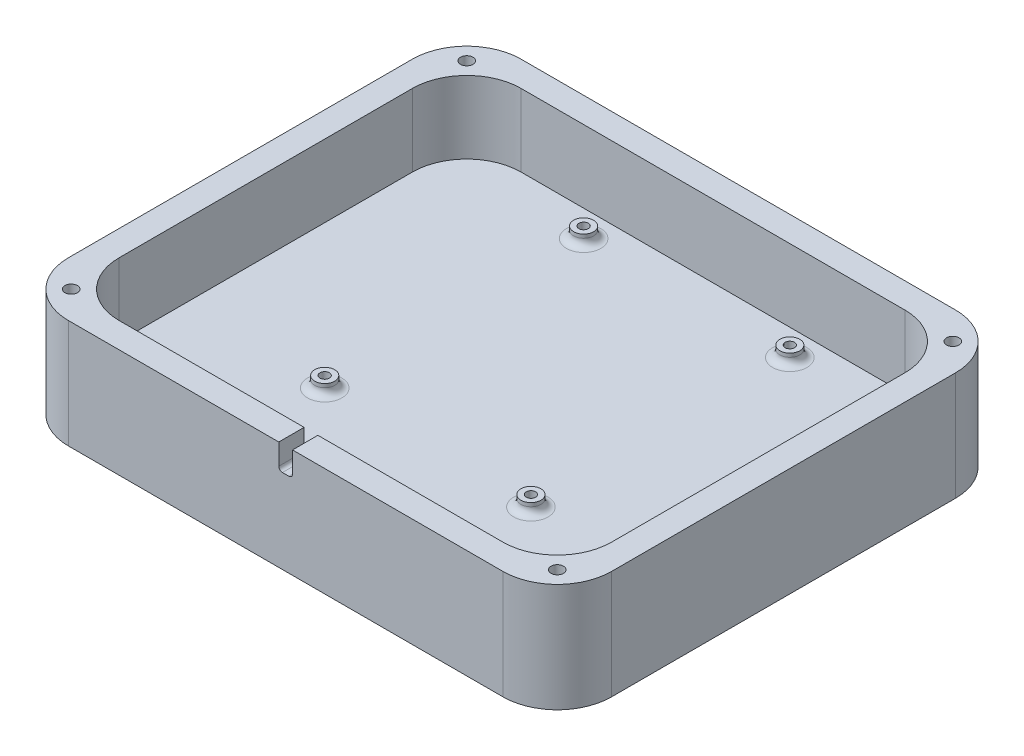
from build123d import *

# Parameters (mm, degrees)
SKETCH1_W                 = 150
SKETCH1_H                 = 100
BOSS_EXTRUDE1_DEPTH       = 10
SKETCH2_R                 = 2.75
BOSS_EXTRUDE2_DEPTH       = 3
F_1_0MM_DOWEL_HOLE1_D     = 2.6
F_1_0MM_DOWEL_HOLE1_DEPTH = 10
F_1_0MM_DOWEL_HOLE1_TIP   = 0.781118805
FILLET1_R                 = 2
SKETCH5_W                 = 150
SKETCH5_H                 = 25
BOSS_EXTRUDE3_DEPTH       = 10
SKETCH7_W                 = 150
SKETCH7_H                 = 125
SKETCH7_W_2               = 136
SKETCH7_H_2               = 111
EXTRUDE_THIN1_DEPTH       = 20
CUT_EXTRUDE1_REACH        = 150.829
FILLET2_R                 = 15
FILLET3_R                 = 15
SKETCH9_R                 = 1.725
CUT_EXTRUDE2_DEPTH        = 6


with BuildPart() as part:
    # Sketch1 → Boss-Extrude1 (new body)
    with BuildSketch(Plane(origin=(0, 0, 0), x_dir=(1, 0, 0), z_dir=(0, 1, 0))):
        Rectangle(SKETCH1_W, SKETCH1_H)
    extrude(amount=BOSS_EXTRUDE1_DEPTH)

    # Sketch2 → Boss-Extrude2 (add)
    with BuildSketch(Plane(origin=(0, 10, 0), x_dir=(1, 0, 0), z_dir=(0, 1, 0))):
        with Locations(Location((28.47, 35.745, 0), (0, 0, 270))):
            Circle(SKETCH2_R)
        with Locations(Location((28.47, -35.745, 0), (0, 0, 90))):
            Circle(SKETCH2_R)
        with Locations(Location((-28.47, -35.745, 0), (0, 0, 270))):
            Circle(SKETCH2_R)
        with Locations(Location((-28.47, 35.745, 0), (0, 0, 90))):
            Circle(SKETCH2_R)
    extrude(amount=BOSS_EXTRUDE2_DEPTH)

    # Ø1.0mm Dowel Hole1
    with Locations(Plane(origin=(0, 13, 0), x_dir=(1, 0, 0), z_dir=(0, 1, 0))):
        with Locations((-28.47, 35.745), (28.47, 35.745), (28.47, -35.745), (-28.47, -35.745)):
            Hole(F_1_0MM_DOWEL_HOLE1_D / 2, depth=F_1_0MM_DOWEL_HOLE1_DEPTH)
            with Locations((0, 0, -(F_1_0MM_DOWEL_HOLE1_DEPTH + F_1_0MM_DOWEL_HOLE1_TIP / 2))):  # 118° drill point
                Cone(0, F_1_0MM_DOWEL_HOLE1_D / 2, F_1_0MM_DOWEL_HOLE1_TIP, mode=Mode.SUBTRACT)

    # Fillet1
    fillet1_edges = [part.edges().sort_by_distance(p)[0] for p in [
        (-28.47, 10, 32.995),
        (28.47, 10, -38.495),
        (28.47, 10, 38.495),
        (-28.47, 10, -32.995),
    ]]
    fillet(fillet1_edges, radius=FILLET1_R)

    # Sketch5 → Boss-Extrude3 (add)
    with BuildSketch(Plane.XZ):
        with Locations((0, 62.5)):
            Rectangle(SKETCH5_W, SKETCH5_H)
    extrude(amount=-BOSS_EXTRUDE3_DEPTH)

    # Sketch7 → Extrude-Thin1 (add)
    with BuildSketch(Plane(origin=(0, 10, 0), x_dir=(1, 0, 0), z_dir=(0, 1, 0))):
        with Locations((0, -12.5)):
            Rectangle(SKETCH7_W, SKETCH7_H)
        with Locations((0, -12.5)):
            Rectangle(SKETCH7_W_2, SKETCH7_H_2, mode=Mode.SUBTRACT)
    extrude(amount=EXTRUDE_THIN1_DEPTH)

    # Sketch8 → Cut-Extrude1 (cut, up to next)
    with BuildSketch(Plane.XY.offset(75), mode=Mode.PRIVATE) as cut_extrude1_sk1:
        with BuildLine():
            Line((-1.9, 30), (1.9, 30))
            Line((1.9, 30), (1.9, 24.2))
            ThreePointArc((1.9, 24.2), (1.607106781, 23.492893219), (0.9, 23.2))
            Line((0.9, 23.2), (-0.9, 23.2))
            ThreePointArc((-0.9, 23.2), (-1.607106781, 23.492893219), (-1.9, 24.2))
            Line((-1.9, 24.2), (-1.9, 30))
        make_face()
    cut_extrude1_tool1 = extrude(cut_extrude1_sk1.sketch, amount=-CUT_EXTRUDE1_REACH, mode=Mode.PRIVATE) & part.part
    add(cut_extrude1_tool1.solids().sort_by_distance((0, 26.653655, 75))[0], mode=Mode.SUBTRACT)

    # Fillet2
    fillet2_edges = [part.edges().sort_by_distance(p)[0] for p in [
        (-75, 15, 75),
        (75, 15, 75),
        (-75, 15, -50),
        (75, 15, -50),
    ]]
    fillet(fillet2_edges, radius=FILLET2_R)

    # Fillet3
    fillet3_edges = [part.edges().sort_by_distance(p)[0] for p in [
        (-68, 20, 68),
        (68, 20, 68),
        (68, 20, -43),
        (-68, 20, -43),
    ]]
    fillet(fillet3_edges, radius=FILLET3_R)

    # Sketch9 → Cut-Extrude2 (cut)
    with BuildSketch(Plane(origin=(0, 30, 0), x_dir=(1, 0, 0), z_dir=(0, 1, 0))):
        with Locations(Location((-67.106601718, 42.106601718, 0), (0, 0, 270))):
            Circle(SKETCH9_R)
        with Locations(Location((67.106601718, 42.106601718, 0), (0, 0, 90))):
            Circle(SKETCH9_R)
        with Locations(Location((67.106601718, -67.106601718, 0), (0, 0, 270))):
            Circle(SKETCH9_R)
        with Locations(Location((-67.106601718, -67.106601718, 0), (0, 0, 90))):
            Circle(SKETCH9_R)
    extrude(amount=-CUT_EXTRUDE2_DEPTH, mode=Mode.SUBTRACT)


solid = part.part
